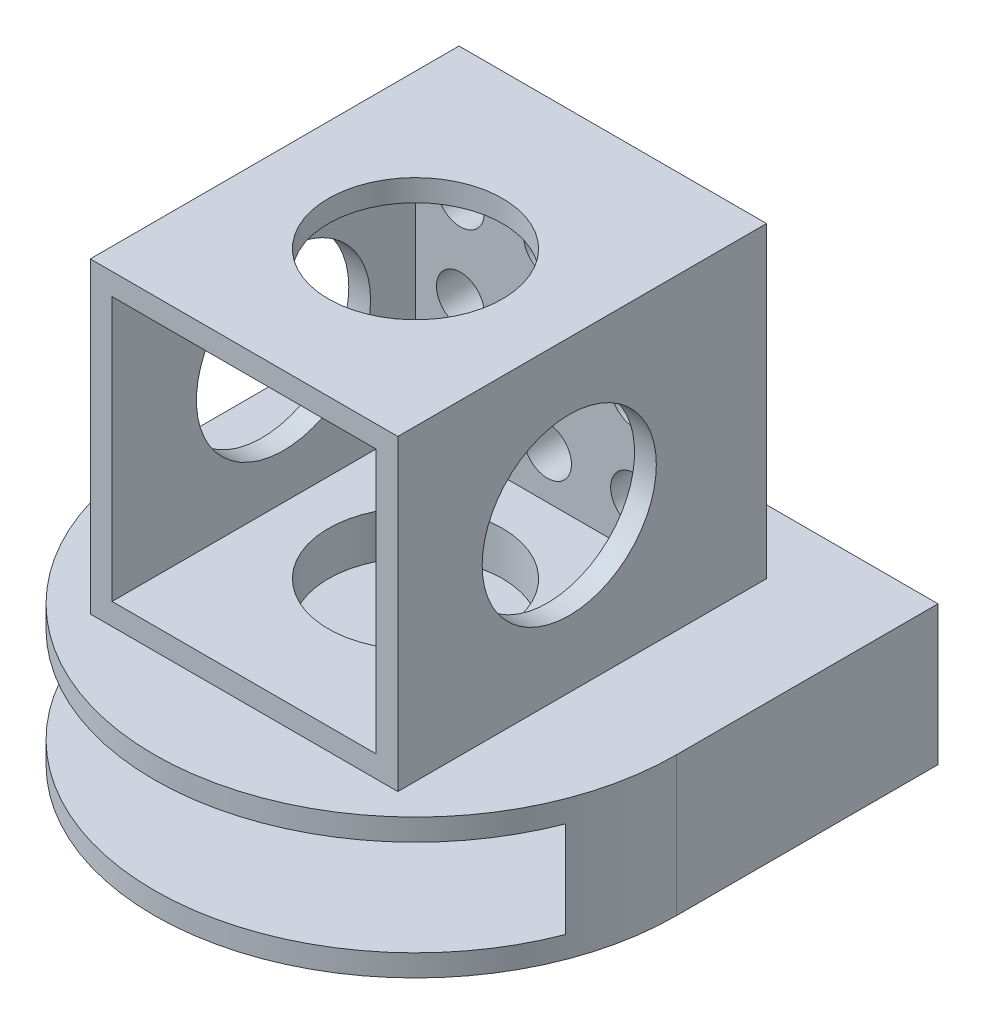
from build123d import *

# Parameters (mm, degrees)
SKETCH1_W                 = 44.85
SKETCH1_H                 = 44.85
SKETCH1_W_2               = 38.5
SKETCH1_H_2               = 38.5
BOSS_EXTRUDE1_DEPTH       = 19.25
SKETCH2_W                 = 44.85
SKETCH2_H                 = 44.85
BOSS_EXTRUDE2_DEPTH       = 3.175
SKETCH3_W                 = 44.85
SKETCH3_H                 = 44.85
BOSS_EXTRUDE3_DEPTH       = 3.175
SKETCH5_R                 = 12.7
CUT_EXTRUDE1_DEPTH        = 3.175
SKETCH8_W                 = 44.85
SKETCH8_H                 = 44.85
SKETCH8_R                 = 2.2225
BOSS_EXTRUDE4_DEPTH       = 6.35
SKETCH9_R                 = 3.4925
CUT_EXTRUDE4_DEPTH        = 6.35
CUT_EXTRUDE5_REACH        = 62.226
SKETCH10_W                = 38.5
SKETCH10_H                = 38.5
SKETCH15_W                = 44.85
SKETCH15_H                = 44.85
SKETCH15_W_2              = 38.5
SKETCH15_H_2              = 38.5
BOSS_EXTRUDE8_DEPTH       = 2.575
CUT_EXTRUDE3_DEPTH        = 43.822445925
CUT_EXTRUDE3_DEPTH_BACK   = 43.822445925
SKETCH7_R                 = 12.7
SKETCH16_R                = 38.1
BOSS_EXTRUDE9_DEPTH       = 20.32
CUT_EXTRUDE2_DEPTH        = 69.777576469
CUT_EXTRUDE2_DEPTH_BACK   = 69.777576469
SKETCH6_R                 = 12.7
CUT_EXTRUDE6_START        = -3.175
CUT_EXTRUDE6_DEPTH        = 13.97
BOSS_EXTRUDE10_REACH      = 108.878
BOSS_EXTRUDE10_END_RADIUS = 38.1
BOSS_EXTRUDE10_START      = -38.1
SKETCH18_W                = 76.2
SKETCH18_H                = 20.32


with BuildPart() as part:
    # Sketch1 → Boss-Extrude1 (new, symmetric)
    with BuildSketch(Plane(origin=(0, 0, 0), x_dir=(1, 0, 0), z_dir=(0, 1, 0))):
        Rectangle(SKETCH1_W, SKETCH1_H)
        Rectangle(SKETCH1_W_2, SKETCH1_H_2, mode=Mode.SUBTRACT)
    extrude(amount=BOSS_EXTRUDE1_DEPTH, both=True)

    # Sketch2 → Boss-Extrude2 (add)
    with BuildSketch(Plane(origin=(0, 19.25, 0), x_dir=(1, 0, 0), z_dir=(0, 1, 0))):
        Rectangle(SKETCH2_W, SKETCH2_H)
    extrude(amount=BOSS_EXTRUDE2_DEPTH)

    # Sketch3 → Boss-Extrude3 (add)
    with BuildSketch(Plane.XZ.offset(19.25)):
        Rectangle(SKETCH3_W, SKETCH3_H)
    extrude(amount=BOSS_EXTRUDE3_DEPTH)

    # Sketch5 → Cut-Extrude1 (cut)
    with BuildSketch(Plane(origin=(0, -22.425, -22.425), x_dir=(1, 0, 0), z_dir=(0, 1, 0))):
        with Locations(Location((0, -22.425, 0), (0, 0, 90))):
            Circle(SKETCH5_R)
    extrude(amount=CUT_EXTRUDE1_DEPTH, mode=Mode.SUBTRACT)

    # Sketch8 → Boss-Extrude4 (add)
    with BuildSketch(Plane(origin=(0, 0, -22.425), x_dir=(-1, 0, 0), z_dir=(0, 0, -1))):
        Rectangle(SKETCH8_W, SKETCH8_H)
        with Locations((-12.7, 12.7)):
            Circle(SKETCH8_R, mode=Mode.SUBTRACT)
        with Locations((0, 12.7)):
            Circle(SKETCH8_R, mode=Mode.SUBTRACT)
        with Locations((12.7, 12.7)):
            Circle(SKETCH8_R, mode=Mode.SUBTRACT)
        Circle(SKETCH8_R, mode=Mode.SUBTRACT)
        with Locations((12.7, 0)):
            Circle(SKETCH8_R, mode=Mode.SUBTRACT)
        with Locations((0, -12.7)):
            Circle(SKETCH8_R, mode=Mode.SUBTRACT)
        with Locations((12.7, -12.7)):
            Circle(SKETCH8_R, mode=Mode.SUBTRACT)
        with Locations((-12.7, 0)):
            Circle(SKETCH8_R, mode=Mode.SUBTRACT)
        with Locations((-12.7, -12.7)):
            Circle(SKETCH8_R, mode=Mode.SUBTRACT)
    extrude(amount=BOSS_EXTRUDE4_DEPTH)

    # Sketch9 → Cut-Extrude4 (cut)
    with BuildSketch(Plane.XY.offset(-19.25)):
        with Locations((12.7, 12.7)):
            Circle(SKETCH9_R)
        with Locations((0, 12.7)):
            Circle(SKETCH9_R)
        with Locations((-12.7, 12.7)):
            Circle(SKETCH9_R)
        Circle(SKETCH9_R)
        with Locations((-12.7, 0)):
            Circle(SKETCH9_R)
        with Locations((0, -12.7)):
            Circle(SKETCH9_R)
        with Locations((-12.7, -12.7)):
            Circle(SKETCH9_R)
        with Locations((12.7, 0)):
            Circle(SKETCH9_R)
        with Locations((12.7, -12.7)):
            Circle(SKETCH9_R)
    extrude(amount=-CUT_EXTRUDE4_DEPTH, mode=Mode.SUBTRACT)

    # Sketch10 → Cut-Extrude5 (cut, up to next)
    with BuildSketch(Plane.XY.offset(22.425), mode=Mode.PRIVATE) as cut_extrude5_sk1:
        Rectangle(SKETCH10_W, SKETCH10_H)
    cut_extrude5_tool1 = extrude(cut_extrude5_sk1.sketch, amount=-CUT_EXTRUDE5_REACH, mode=Mode.PRIVATE) & part.part
    add(cut_extrude5_tool1.solids().sort_by_distance((0, 0, 22.425))[0], mode=Mode.SUBTRACT)

    # Sketch15 → Boss-Extrude8 (add)
    with BuildSketch(Plane.XY.offset(22.425)):
        Rectangle(SKETCH15_W, SKETCH15_H)
        Rectangle(SKETCH15_W_2, SKETCH15_H_2, mode=Mode.SUBTRACT)
    extrude(amount=BOSS_EXTRUDE8_DEPTH)

    # Sketch7 → Cut-Extrude3 (cut, two sides: drawn at the far end of the back side and taken through both)
    with BuildSketch(Plane.ZY.offset(-CUT_EXTRUDE3_DEPTH_BACK)):
        with Locations(Location((0, 0, 0), (0, 0, 180))):
            Circle(SKETCH7_R)
    extrude(amount=CUT_EXTRUDE3_DEPTH + CUT_EXTRUDE3_DEPTH_BACK, mode=Mode.SUBTRACT)

    # Sketch16 → Boss-Extrude9 (add)
    with BuildSketch(Plane.XZ.offset(22.425)):
        with Locations(Location((0, 0, 0), (0, 0, 270))):
            Circle(SKETCH16_R)
    extrude(amount=BOSS_EXTRUDE9_DEPTH)

    # Sketch6 → Cut-Extrude2 (cut, two sides: drawn at the far end of the back side and taken through both)
    with BuildSketch(Plane(origin=(0, 0, 0), x_dir=(1, 0, 0), z_dir=(0, 1, 0)).offset(-CUT_EXTRUDE2_DEPTH_BACK)):
        with Locations(Location((0, 0, 0), (0, 0, 90))):
            Circle(SKETCH6_R)
    extrude(amount=CUT_EXTRUDE2_DEPTH + CUT_EXTRUDE2_DEPTH_BACK, mode=Mode.SUBTRACT)

    # Sketch17 → Cut-Extrude6 (cut)
    with BuildSketch(Plane.XZ.offset(42.745).offset(CUT_EXTRUDE6_START)):
        with BuildLine():
            Line((-35.56, 0), (-35.56, 38.1))
            Line((-35.56, 38.1), (35.56, 38.1))
            Line((35.56, 38.1), (35.56, 0))
            ThreePointArc((35.56, 0), (0, -35.56), (-35.56, 0))
        make_face()
    extrude(amount=-CUT_EXTRUDE6_DEPTH, mode=Mode.SUBTRACT)

    # Boss-Extrude10: up to this cylinder (the profile starts outside it)
    boss_extrude10_end = Plane(origin=(0, -32.585, 0), z_dir=(0, 1, 0)) * Cylinder(BOSS_EXTRUDE10_END_RADIUS, 294.956, mode=Mode.PRIVATE)
    # Sketch18 → Boss-Extrude10 (add, up to the surface)
    with BuildSketch(Plane.XY.offset(BOSS_EXTRUDE10_START), mode=Mode.PRIVATE) as boss_extrude10_sk1:
        with Locations((0, -32.585)):
            Rectangle(SKETCH18_W, SKETCH18_H)
    boss_extrude10_tool1 = extrude(boss_extrude10_sk1.sketch, amount=BOSS_EXTRUDE10_REACH, mode=Mode.PRIVATE) - boss_extrude10_end
    add(boss_extrude10_tool1.solids().sort_by_distance((0, -32.585, -38.1))[0])
    add(boss_extrude10_tool1.solids().sort_by_distance((0, -32.585, -38.1))[1])


solid = part.part
